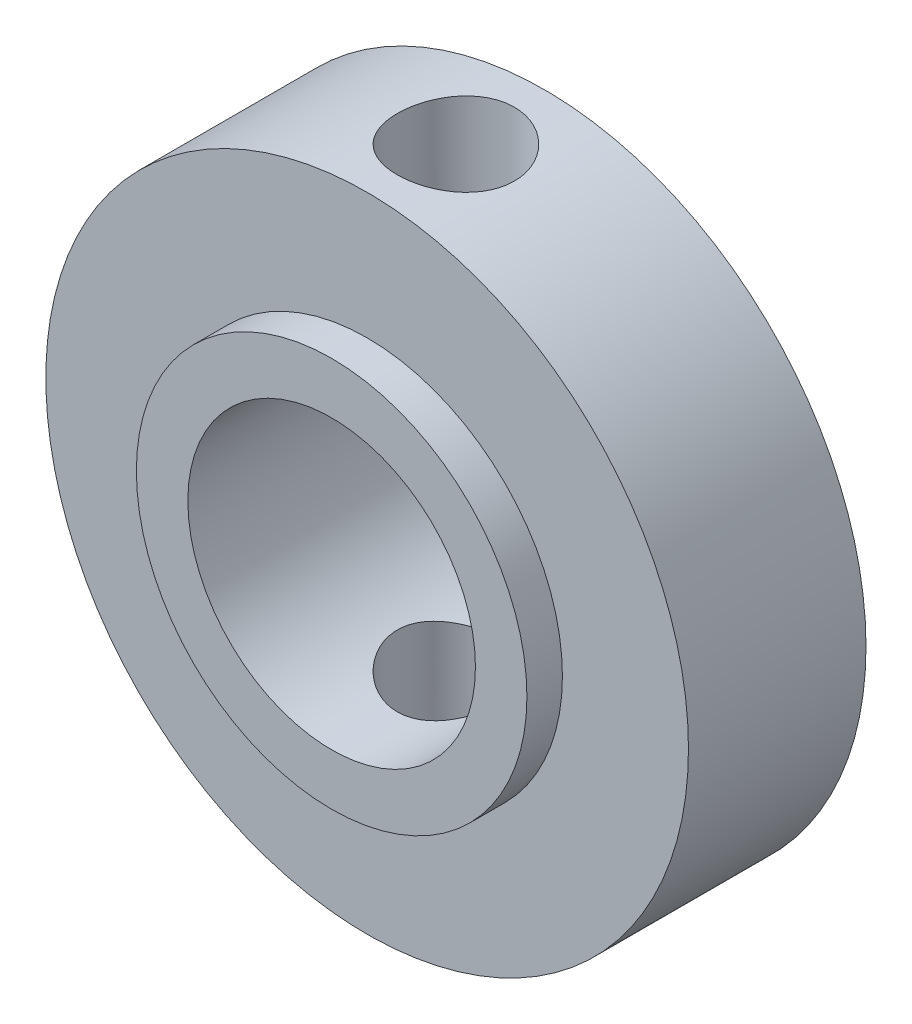
from build123d import *

# Parameters (mm, degrees)
ESQUISSE1_R                  = 9.05
ESQUISSE1_R_2                = 4.05
BOSS_EXTRU_1_DEPTH           = 5
ENL_V_MAT_EXTRU_1_DEPTH      = 14.740633173
ENL_V_MAT_EXTRU_1_DEPTH_BACK = 14.740633173
ESQUISSE2_R                  = 1.65
ESQUISSE3_R                  = 5.5
ESQUISSE3_R_2                = 4.05
BOSS_EXTRU_2_DEPTH           = 1


with BuildPart() as part:
    # Esquisse1 → Boss.-Extru.1 (new body)
    with BuildSketch(Plane.XY):
        Circle(ESQUISSE1_R)
        Circle(ESQUISSE1_R_2, mode=Mode.SUBTRACT)
    extrude(amount=BOSS_EXTRU_1_DEPTH)

    # Esquisse2 → Enlèv. mat.-Extru.1 (cut, two sides: drawn at the far end of the back side and taken through both)
    with BuildSketch(Plane(origin=(0, 0, 0), x_dir=(1, 0, 0), z_dir=(0, 1, 0)).offset(-ENL_V_MAT_EXTRU_1_DEPTH_BACK)):
        with Locations(Location((0, -2.5, 0), (0, 0, 270))):
            Circle(ESQUISSE2_R)
    extrude(amount=ENL_V_MAT_EXTRU_1_DEPTH + ENL_V_MAT_EXTRU_1_DEPTH_BACK, mode=Mode.SUBTRACT)

    # Esquisse3 → Boss.-Extru.2 (add)
    with BuildSketch(Plane.XY.offset(5)):
        Circle(ESQUISSE3_R)
        Circle(ESQUISSE3_R_2, mode=Mode.SUBTRACT)
    extrude(amount=BOSS_EXTRU_2_DEPTH)


solid = part.part
